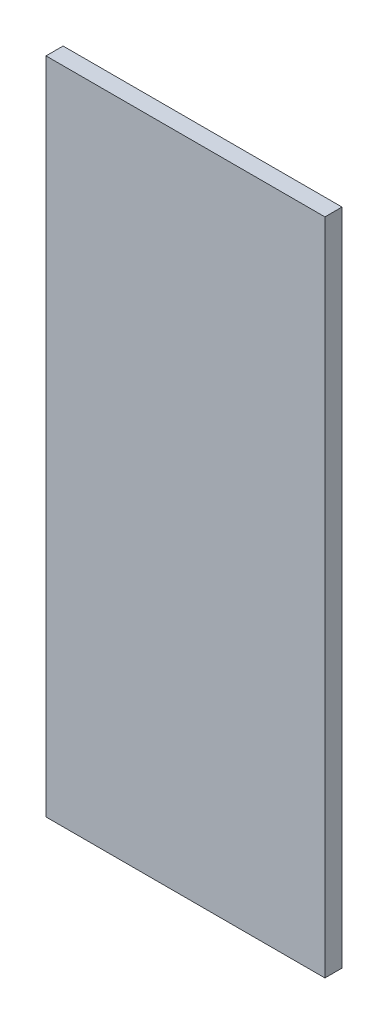
from build123d import *

# Parameters (mm, degrees)
ESQUISSE1_W        = 245
ESQUISSE1_H        = 579
BOSS_EXTRU_1_DEPTH = 15


with BuildPart() as part:
    # Esquisse1 → Boss.-Extru.1 (new body)
    with BuildSketch(Plane.XY):
        with Locations((122.5, 289.5)):
            Rectangle(ESQUISSE1_W, ESQUISSE1_H)
    extrude(amount=BOSS_EXTRU_1_DEPTH)


solid = part.part
